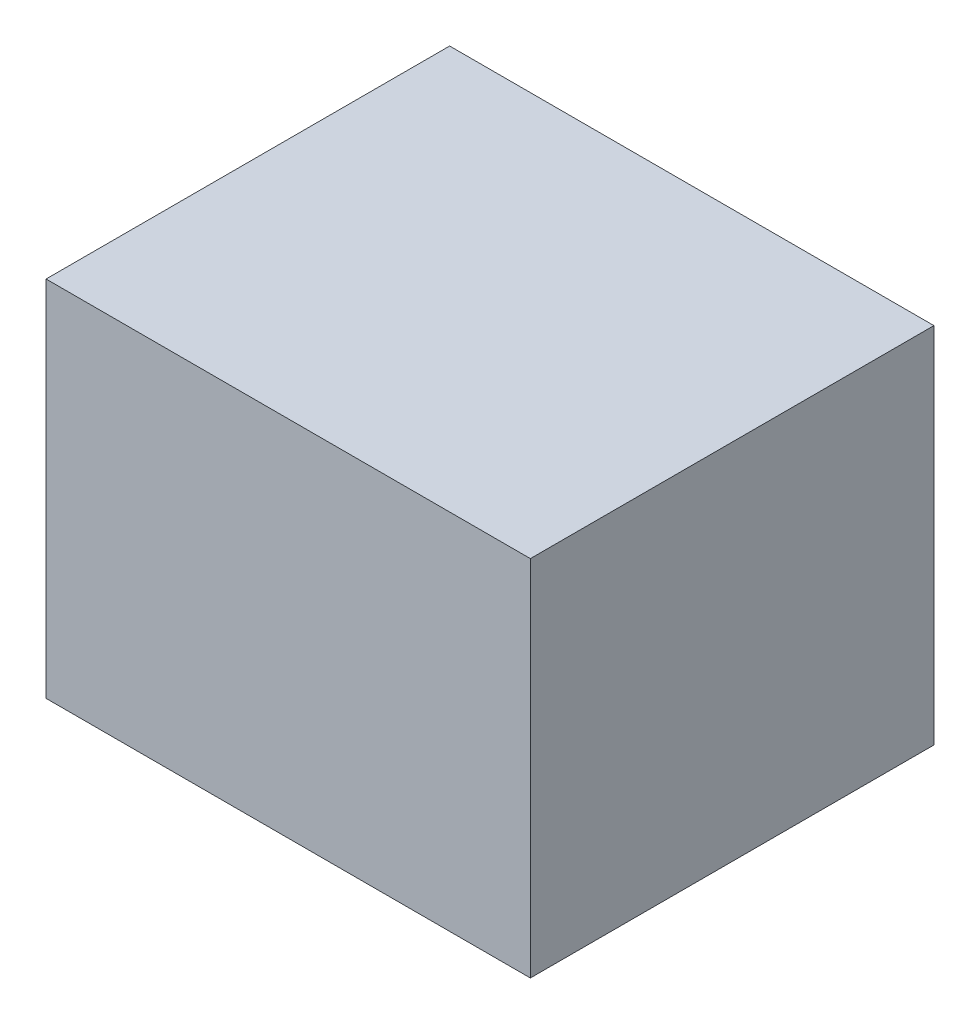
from build123d import *

# Parameters (mm, degrees)
SKETCH1_W           = 304.8
SKETCH1_H           = 254
BOSS_EXTRUDE1_DEPTH = 228.6


with BuildPart() as part:
    # Sketch1 → Boss-Extrude1 (new body)
    with BuildSketch(Plane(origin=(0, 0, 0), x_dir=(1, 0, 0), z_dir=(0, 1, 0))):
        Rectangle(SKETCH1_W, SKETCH1_H)
    extrude(amount=BOSS_EXTRUDE1_DEPTH)


solid = part.part
